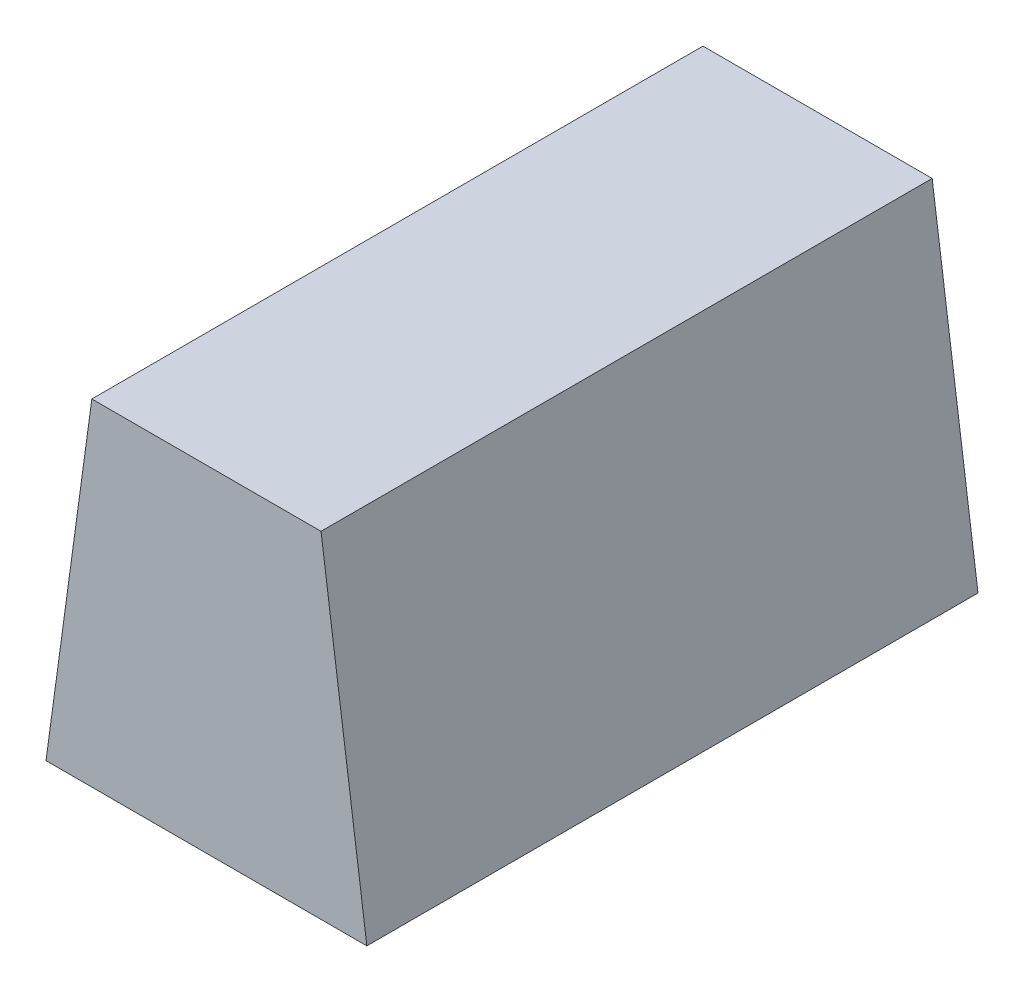
from build123d import *

# Parameters (mm, degrees)
SALIENTE_EXTRUIR1_DEPTH = 40


with BuildPart() as part:
    # Croquis1 → Saliente-Extruir1 (new body)
    with BuildSketch(Plane.XY):
        Polygon((0, 0), (21, 0), (18, 22), (3, 22), align=None)
    extrude(amount=SALIENTE_EXTRUIR1_DEPTH)


solid = part.part
